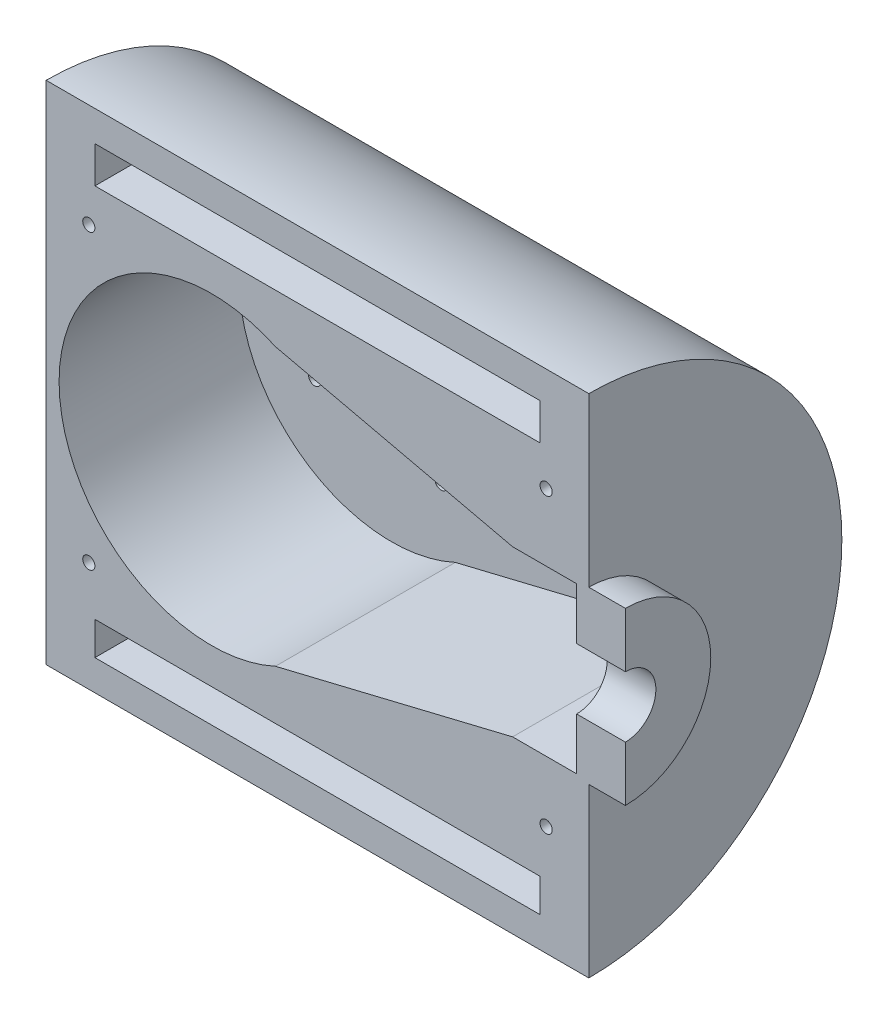
from build123d import *

# Parameters (mm, degrees)
BOSS_EXTRUDE2_DEPTH = 87
CUT_EXTRUDE1_DEPTH  = 29.5
SKETCH3_R           = 4.5
SKETCH3_R_2         = 1
CUT_EXTRUDE2_DEPTH  = 130.771336418
SKETCH4_R           = 14.5
SKETCH4_R_2         = 1.7
CUT_EXTRUDE3_DEPTH  = 10
BOSS_EXTRUDE3_START = 2
BOSS_EXTRUDE3_DEPTH = 2
BOSS_EXTRUDE4_START = 6
BOSS_EXTRUDE4_DEPTH = 6
SKETCH7_W           = 73
SKETCH7_H           = 6
SKETCH7_H_2         = 5.446782016
CUT_EXTRUDE4_DEPTH  = 7
SKETCH8_R           = 1
CUT_EXTRUDE5_DEPTH  = 136.438914135
SKETCH9_R           = 2.5
CUT_EXTRUDE6_DEPTH  = 32


with BuildPart() as part:
    # Sketch1 → Boss-Extrude2 (new body)
    with BuildSketch(Plane(origin=(89.94373008, 0, 0), x_dir=(0, 0, -1), z_dir=(1, 0, 0))):
        with BuildLine():
            Line((-104.016306216, 83.836001664), (-104.016306216, 0.836001664))
            ThreePointArc((-104.016306216, 0.836001664), (-62.516306216, 42.336001664), (-104.016306216, 83.836001664))
        make_face()
    extrude(amount=-BOSS_EXTRUDE2_DEPTH)

    # Sketch2 → Cut-Extrude1 (cut)
    with BuildSketch(Plane.XY.offset(104.016306216)):
        with BuildLine():
            Line((89.94373008, 55.836001595), (79.445092487, 55.836001664))
            Line((79.445092487, 55.836001664), (40.551337791, 64.805487997))
            ThreePointArc((40.551337791, 64.805487997), (5.067466824, 42.109927869), (40.551337791, 19.414367741))
            Line((40.551337791, 19.414367741), (79.445092487, 28.836001664))
            Line((79.445092487, 28.836001664), (89.94373008, 28.836001664))
            Line((89.94373008, 28.836001664), (89.94373008, 55.836001595))
        make_face()
    extrude(amount=-CUT_EXTRUDE1_DEPTH, mode=Mode.SUBTRACT)

    # Sketch3 → Cut-Extrude2 (cut, through all)
    with BuildSketch(Plane(origin=(0, 0, 62.516306216), x_dir=(-1, 0, 0), z_dir=(0, 0, -1))):
        with Locations(Location((-61.067466824, 42.109927869, 0), (0, 0, 90))):
            Circle(SKETCH3_R)
        with Locations(Location((-42.657418818, 50.264258545, 0), (0, 0, 90))):
            Circle(SKETCH3_R_2)
        with Locations(Location((-21.913136148, 54.699879864, 0), (0, 0, 90))):
            Circle(SKETCH3_R_2)
        with Locations(Location((-38.2217975, 29.519975875, 0), (0, 0, 90))):
            Circle(SKETCH3_R_2)
        with Locations(Location((-17.477514829, 33.955597193, 0), (0, 0, 90))):
            Circle(SKETCH3_R_2)
    extrude(amount=-CUT_EXTRUDE2_DEPTH, mode=Mode.SUBTRACT)

    # Sketch4 → Cut-Extrude3 (cut)
    with BuildSketch(Plane(origin=(0, 0, 62.516306216), x_dir=(-1, 0, 0), z_dir=(0, 0, -1))):
        with Locations(Location((-61.067466824, 42.109927869, 0), (0, 0, 90))):
            Circle(SKETCH4_R)
        with Locations(Location((-42.657418818, 50.264258545, 0), (0, 0, 90))):
            Circle(SKETCH4_R_2)
        with Locations(Location((-21.913136148, 54.699879864, 0), (0, 0, 90))):
            Circle(SKETCH4_R_2)
        with Locations(Location((-38.2217975, 29.519975875, 0), (0, 0, 90))):
            Circle(SKETCH4_R_2)
        with Locations(Location((-17.477514829, 33.955597193, 0), (0, 0, 90))):
            Circle(SKETCH4_R_2)
    extrude(amount=-CUT_EXTRUDE3_DEPTH, mode=Mode.SUBTRACT)

    # Sketch5 → Boss-Extrude3 (add)
    with BuildSketch(Plane(origin=(89.94373008, 0, 0), x_dir=(0, 0, -1), z_dir=(1, 0, 0)).offset(BOSS_EXTRUDE3_START)):
        with BuildLine():
            Line((-104.016306216, 55.836001595), (-104.016306216, 47.336001664))
            ThreePointArc((-104.016306216, 47.336001664), (-99.016306216, 42.336001664), (-104.016306216, 37.336001664))
            Line((-104.016306216, 37.336001664), (-104.016306216, 28.836001664))
            Line((-104.016306216, 28.836001664), (-104.016306216, 0.836001664))
            ThreePointArc((-104.016306216, 0.836001664), (-62.516306216, 42.336001664), (-104.016306216, 83.836001664))
            Line((-104.016306216, 83.836001664), (-104.016306216, 55.836001595))
        make_face()
    extrude(amount=-BOSS_EXTRUDE3_DEPTH)

    # Sketch6 → Boss-Extrude4 (add)
    with BuildSketch(Plane(origin=(91.94373008, 0, 0), x_dir=(0, 0, -1), z_dir=(1, 0, 0)).offset(BOSS_EXTRUDE4_START)):
        with BuildLine():
            Line((-104.016306216, 56.336001664), (-104.016306216, 47.336001664))
            ThreePointArc((-104.016306216, 47.336001664), (-99.016306216, 42.336001664), (-104.016306216, 37.336001664))
            Line((-104.016306216, 37.336001664), (-104.016306216, 28.336001664))
            ThreePointArc((-104.016306216, 28.336001664), (-90.016306216, 42.336001664), (-104.016306216, 56.336001664))
        make_face()
    extrude(amount=-BOSS_EXTRUDE4_DEPTH)

    # Sketch7 → Cut-Extrude4 (cut)
    with BuildSketch(Plane.XY.offset(104.016306216)):
        with Locations((47.44373008, 75.836001664)):
            Rectangle(SKETCH7_W, SKETCH7_H)
        with Locations((47.44373008, 8.559392672)):
            Rectangle(SKETCH7_W, SKETCH7_H_2)
    extrude(amount=-CUT_EXTRUDE4_DEPTH, mode=Mode.SUBTRACT)

    # Sketch8 → Cut-Extrude5 (cut, through all)
    with BuildSketch(Plane(origin=(0, 0, 62.516306216), x_dir=(-1, 0, 0), z_dir=(0, 0, -1))):
        with Locations(Location((-84.94373008, 66.836001664, 0), (0, 0, 90))):
            Circle(SKETCH8_R)
        with Locations(Location((-84.94373008, 18.836001664, 0), (0, 0, 90))):
            Circle(SKETCH8_R)
        with Locations(Location((-9.94373008, 66.836001664, 0), (0, 0, 90))):
            Circle(SKETCH8_R)
        with Locations(Location((-9.94373008, 18.836001664, 0), (0, 0, 90))):
            Circle(SKETCH8_R)
    extrude(amount=-CUT_EXTRUDE5_DEPTH, mode=Mode.SUBTRACT)

    # Sketch9 → Cut-Extrude6 (cut)
    with BuildSketch(Plane(origin=(0, 0, 62.516306216), x_dir=(-1, 0, 0), z_dir=(0, 0, -1))):
        with Locations(Location((-84.94373008, 66.836001664, 0), (0, 0, 90))):
            Circle(SKETCH9_R)
        with Locations(Location((-84.94373008, 18.836001664, 0), (0, 0, 90))):
            Circle(SKETCH9_R)
        with Locations(Location((-9.94373008, 66.836001664, 0), (0, 0, 90))):
            Circle(SKETCH9_R)
        with Locations(Location((-9.94373008, 18.836001664, 0), (0, 0, 90))):
            Circle(SKETCH9_R)
    extrude(amount=-CUT_EXTRUDE6_DEPTH, mode=Mode.SUBTRACT)


solid = part.part
